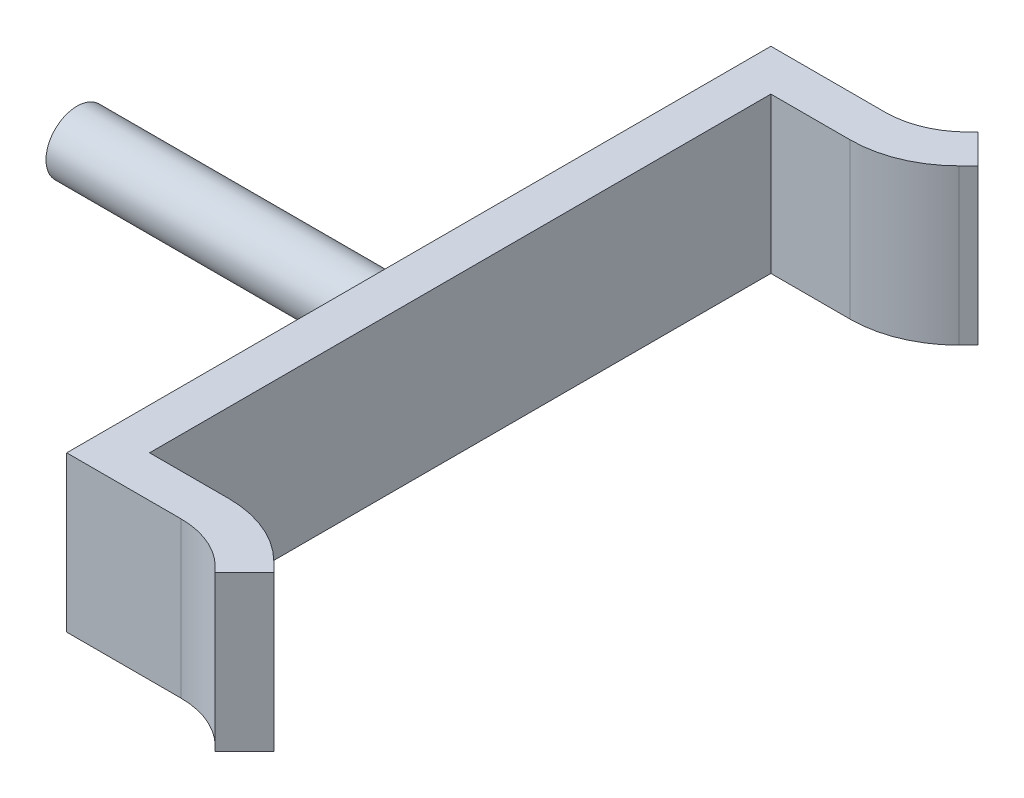
from build123d import *

# Parameters (mm, degrees)
BOSS_EXTRUDE2_DEPTH = 15
SKETCH3_R           = 3
BOSS_EXTRUDE3_DEPTH = 33


with BuildPart() as part:
    # Sketch1 → Boss-Extrude2 (new body)
    with BuildSketch(Plane(origin=(0, 0, 0), x_dir=(1, 0, 0), z_dir=(0, 1, 0))):
        with BuildLine():
            Line((0, 34), (0, 0))
            Line((0, 0), (4, 0))
            Line((4, 0), (4, 30))
            Line((4, 30), (11.650757595, 30))
            ThreePointArc((11.650757595, 30), (15.668933635, 30.799264909), (19.075378798, 33.075378798))
            Line((19.075378798, 33.075378798), (20, 34))
            Line((20, 34), (17.171572875, 36.828427125))
            Line((17.171572875, 36.828427125), (16.686291501, 36.343145751))
            ThreePointArc((16.686291501, 36.343145751), (14.09090471, 34.60896374), (11.029437252, 34))
            Line((11.029437252, 34), (0, 34))
        make_face()
        with BuildLine():
            Line((0, 0), (0, -34))
            Line((0, -34), (11.029437252, -34))
            ThreePointArc((11.029437252, -34), (14.09090471, -34.60896374), (16.686291501, -36.343145751))
            Line((16.686291501, -36.343145751), (17.171572875, -36.828427125))
            Line((17.171572875, -36.828427125), (20, -34))
            Line((20, -34), (19.075378798, -33.075378798))
            ThreePointArc((19.075378798, -33.075378798), (15.668933635, -30.799264909), (11.650757595, -30))
            Line((11.650757595, -30), (4, -30))
            Line((4, -30), (4, 0))
            Line((4, 0), (0, 0))
        make_face()
    extrude(amount=BOSS_EXTRUDE2_DEPTH)

    # Sketch3 → Boss-Extrude3 (add)
    with BuildSketch(Plane.ZY):
        with Locations((0, 7.5)):
            Circle(SKETCH3_R)
    extrude(amount=BOSS_EXTRUDE3_DEPTH)


solid = part.part
